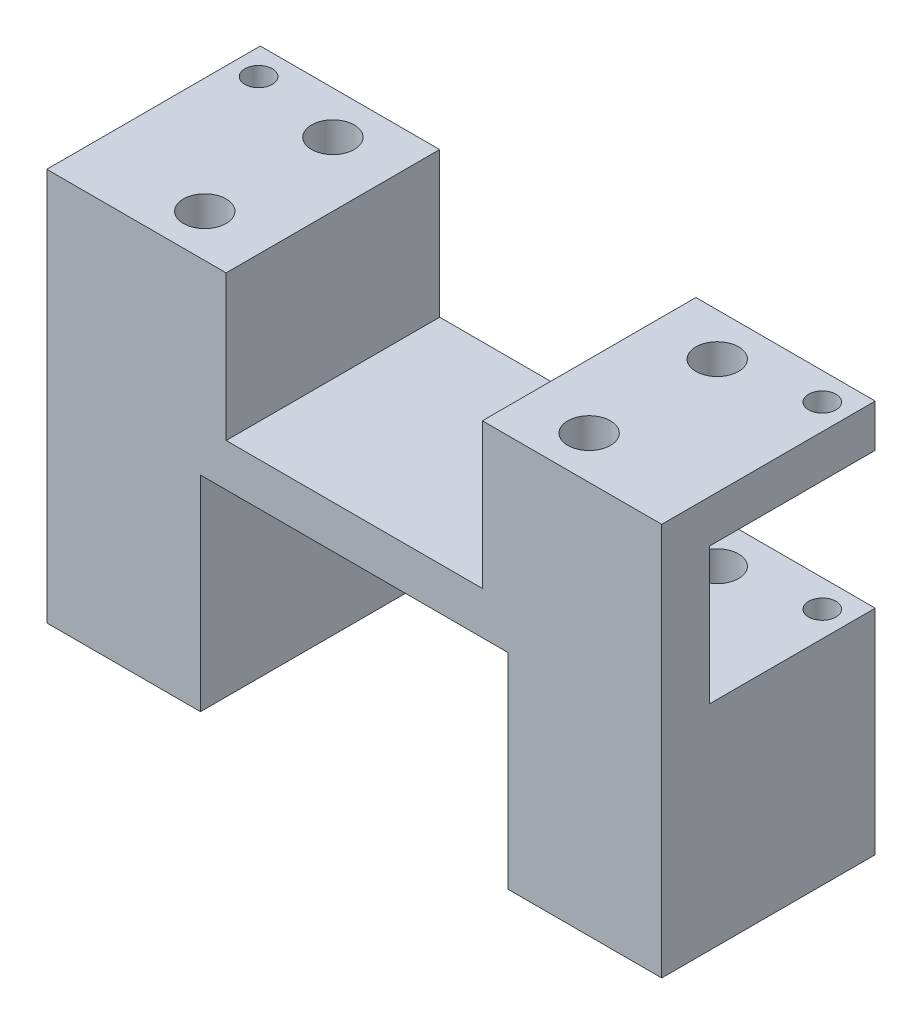
from build123d import *

# Parameters (mm, degrees)
SKETCH6_W           = 72
SKETCH6_H           = 25
BOSS_EXTRUDE2_DEPTH = 46
SKETCH9_R           = 1.6
CUT_EXTRUDE3_DEPTH  = 35
TOP_SCREW_HOLES_D   = 5
SKETCH12_W          = 36
SKETCH12_H          = 24
CUT_EXTRUDE4_DEPTH  = 64.537390567
SKETCH13_W          = 30
SKETCH13_H          = 25
CUT_EXTRUDE5_DEPTH  = 17
CUT_EXTRUDE6_START  = 25
SKETCH14_R          = 16.5
CUT_EXTRUDE6_DEPTH  = 16


with BuildPart() as part:
    # Sketch6 → Boss-Extrude2 (new body)
    with BuildSketch(Plane(origin=(0, 0, 0), x_dir=(1, 0, 0), z_dir=(0, 1, 0))):
        Rectangle(SKETCH6_W, SKETCH6_H)
    extrude(amount=BOSS_EXTRUDE2_DEPTH)

    # Sketch9 → Cut-Extrude3 (cut)
    with BuildSketch(Plane(origin=(0, 46, 0), x_dir=(1, 0, 0), z_dir=(0, 1, 0))):
        with Locations(Location((-33, 9.3, 0), (0, 0, 270))):
            Circle(SKETCH9_R)
        with Locations(Location((33, 9.3, 0), (0, 0, 90))):
            Circle(SKETCH9_R)
    extrude(amount=-CUT_EXTRUDE3_DEPTH, mode=Mode.SUBTRACT)

    # Top Screw Holes (through all)
    with Locations(Plane(origin=(0, 46, 0), x_dir=(1, 0, 0), z_dir=(0, 1, 0))):
        with Locations((-22.5, -7.5), (22.5, -7.5), (-22.5, 7.5), (22.5, 7.5)):
            Hole(TOP_SCREW_HOLES_D / 2)

    # Sketch12 → Cut-Extrude4 (cut, through all)
    with BuildSketch(Plane.XY.offset(12.5)):
        with Locations((0, 12)):
            Rectangle(SKETCH12_W, SKETCH12_H)
    extrude(amount=-CUT_EXTRUDE4_DEPTH, mode=Mode.SUBTRACT)

    # Sketch13 → Cut-Extrude5 (cut)
    with BuildSketch(Plane(origin=(0, 46, 0), x_dir=(1, 0, 0), z_dir=(0, 1, 0))):
        Rectangle(SKETCH13_W, SKETCH13_H)
    extrude(amount=-CUT_EXTRUDE5_DEPTH, mode=Mode.SUBTRACT)

    # Sketch14 → Cut-Extrude6 (cut)
    with BuildSketch(Plane(origin=(0, 0, 0), x_dir=(1, 0, 0), z_dir=(0, 1, 0)).offset(CUT_EXTRUDE6_START)):
        with Locations((-33, 9.3)):
            Circle(SKETCH14_R)
        with Locations((33, 9.3)):
            Circle(SKETCH14_R)
    extrude(amount=CUT_EXTRUDE6_DEPTH, mode=Mode.SUBTRACT)


solid = part.part
